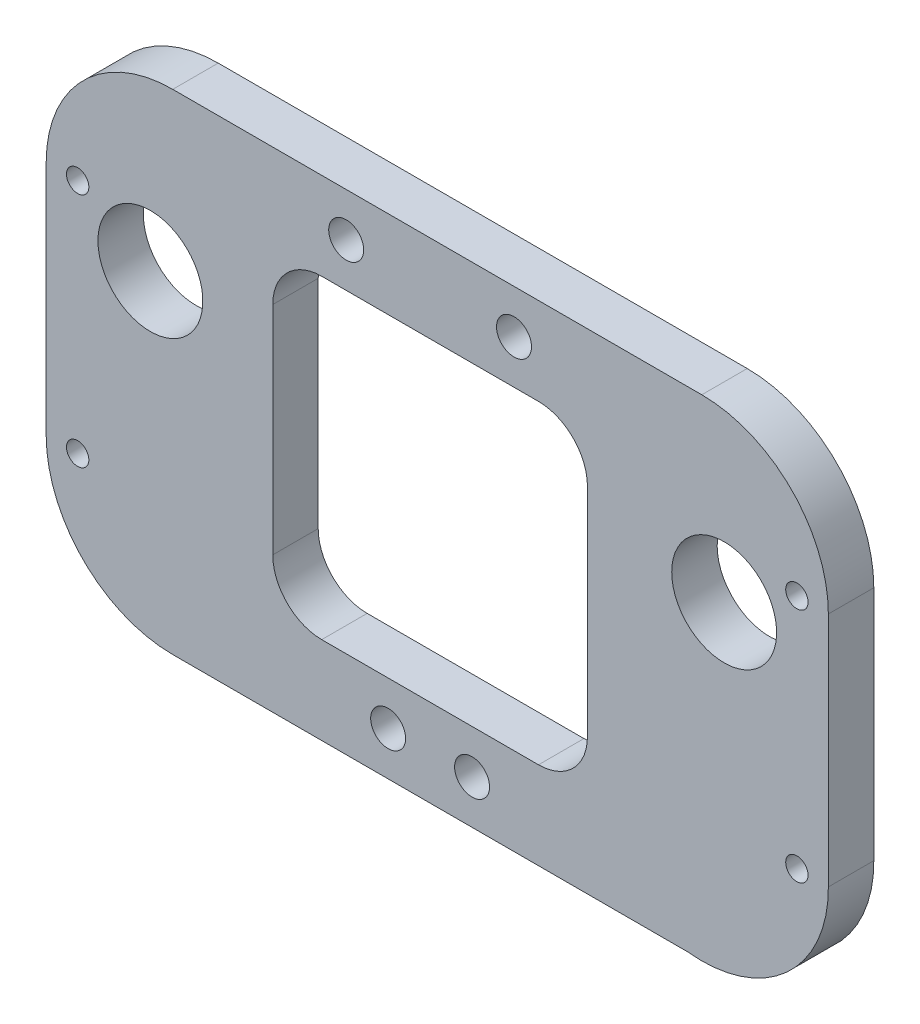
from build123d import *

# Parameters (mm, degrees)
SKETCH_1_R          = 1.6
SKETCH_1_R_2        = 7.5
EXTRUDE_1_DEPTH     = 6.5
SKETCH_3_R          = 2.5
CUT_EXTRUDE_1_DEPTH = 68.222006253


with BuildPart() as part:
    # 草图1 → 凸台-拉伸1 (new body)
    with BuildSketch(Plane.XY):
        with BuildLine():
            Line((-36.800051208, 35), (38.850303739, 35))
            ThreePointArc((38.850303739, 35), (51.648918374, 29.698640239), (56.950278135, 16.900025604))
            Line((56.950278135, 16.900025604), (56.950278135, -16.900025604))
            ThreePointArc((56.950278135, -16.900025604), (50.945911029, -30.48186799), (36.800051208, -35))
            Line((36.800051208, -35), (-36.800051208, -35))
            ThreePointArc((-36.800051208, -35), (-49.598665842, -29.698640239), (-54.900025604, -16.900025604))
            Line((-54.900025604, -16.900025604), (-54.900025604, 16.900025604))
            ThreePointArc((-54.900025604, 16.900025604), (-49.598665842, 29.698640239), (-36.800051208, 35))
        make_face()
        with Locations(Location((-50.400025604, 16.900025604, 0), (0, 0, 180))):
            Circle(SKETCH_1_R, mode=Mode.SUBTRACT)
        with Locations(Location((-40.000025604, 10.900025604, 0), (0, 0, 180))):
            Circle(SKETCH_1_R_2, mode=Mode.SUBTRACT)
        with Locations(Location((52.450278135, 16.900025604, 0), (0, 0, 180))):
            Circle(SKETCH_1_R, mode=Mode.SUBTRACT)
        with Locations(Location((42.050278135, 10.900025604, 0), (0, 0, 180))):
            Circle(SKETCH_1_R_2, mode=Mode.SUBTRACT)
        with Locations(Location((52.450278135, -16.900025604, 0), (0, 0, 180))):
            Circle(SKETCH_1_R, mode=Mode.SUBTRACT)
        with Locations(Location((-50.400025604, -16.900025604, 0), (0, 0, 180))):
            Circle(SKETCH_1_R, mode=Mode.SUBTRACT)
        with BuildLine():
            Line((-15.5, 22.5), (15.5, 22.5))
            ThreePointArc((15.5, 22.5), (20.449747468, 20.449747468), (22.5, 15.5))
            Line((22.5, 15.5), (22.5, -15.5))
            ThreePointArc((22.5, -15.5), (20.449747468, -20.449747468), (15.5, -22.5))
            Line((15.5, -22.5), (-15.5, -22.5))
            ThreePointArc((-15.5, -22.5), (-20.449747468, -20.449747468), (-22.5, -15.5))
            Line((-22.5, -15.5), (-22.5, 15.5))
            ThreePointArc((-22.5, 15.5), (-20.449747468, 20.449747468), (-15.5, 22.5))
        make_face(mode=Mode.SUBTRACT)
    extrude(amount=EXTRUDE_1_DEPTH)

    # 草图3 → 切除-拉伸1 (cut, through all)
    with BuildSketch(Plane.XY.offset(6.5)):
        with Locations((-12, 28.75)):
            Circle(SKETCH_3_R)
        with Locations((12, 28.75)):
            Circle(SKETCH_3_R)
        with Locations((-6, -28.75)):
            Circle(SKETCH_3_R)
        with Locations((6, -28.75)):
            Circle(SKETCH_3_R)
    extrude(amount=-CUT_EXTRUDE_1_DEPTH, mode=Mode.SUBTRACT)


solid = part.part
